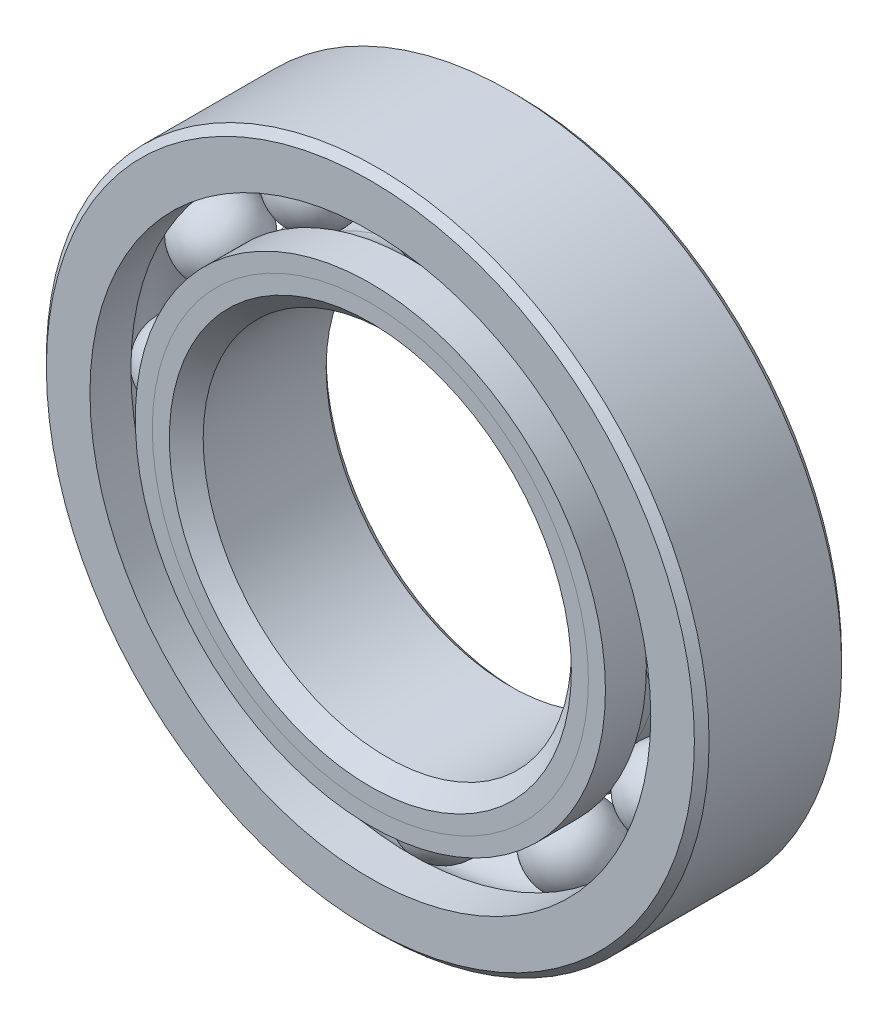
from build123d import *

# Parameters (mm, degrees)
CIRPATTERN1_COUNT = 12


with BuildPart() as part:
    # Sketch1 → Revolve1 (revolve)
    with BuildSketch(Plane(origin=(0, 0, 0), x_dir=(0, 0, -1), z_dir=(1, 0, 0))):
        with BuildLine():
            Line((2.8575, 14.2875), (-2.8575, 14.2875))
            Line((-2.8575, 14.2875), (-3.175, 13.97))
            Line((-3.175, 13.97), (-3.175, 12.089423077))
            Line((-3.175, 12.089423077), (-1.411111111, 12.089423077))
            ThreePointArc((-1.411111111, 12.089423077), (0, 12.828778901), (1.411111111, 12.089423077))
            Line((1.411111111, 12.089423077), (3.175, 12.089423077))
            Line((3.175, 12.089423077), (3.175, 13.97))
            Line((3.175, 13.97), (2.8575, 14.2875))
        make_face()
    revolve(axis=Axis((0, 0, 3.175), (0, 0, -1)))


with BuildPart() as body_2:
    # Sketch2 → Revolve2 (revolve)
    with BuildSketch(Plane(origin=(0, 0, 0), x_dir=(0, 0, -1), z_dir=(1, 0, 0))):
        with BuildLine():
            Line((-3.175, 10.135576923), (-1.411111111, 10.135576923))
            ThreePointArc((-1.411111111, 10.135576923), (-0.796536503, 9.592255656), (0, 9.396221099))
            Line((0, 9.396221099), (0, 8.666860549))
            Line((0, 8.666860549), (-2.440641813, 8.666860549))
            Line((-2.440641813, 8.666860549), (-3.175, 9.401218736))
            Line((-3.175, 9.401218736), (-3.175, 10.135576923))
        make_face()
    revolve(axis=Axis((0, 0, 3.175), (0, 0, -1)))


with BuildPart() as body_3:
    # Sketch3 → Revolve3 (revolve)
    with BuildSketch(Plane(origin=(0, 0, 0), x_dir=(0, 0, -1), z_dir=(1, 0, 0))):
        with BuildLine():
            Line((-3.175, 9.401218736), (-2.440641813, 8.666860549))
            Line((-2.440641813, 8.666860549), (0, 8.666860549))
            Line((0, 8.666860549), (0, 9.396221099))
            ThreePointArc((0, 9.396221099), (0.796536503, 9.592255656), (1.411111111, 10.135576923))
            Line((1.411111111, 10.135576923), (3.175, 10.135576923))
            Line((3.175, 10.135576923), (3.175, 8.255))
            Line((3.175, 8.255), (2.8575, 7.9375))
            Line((2.8575, 7.9375), (-2.445639451, 7.9375))
            Line((-2.445639451, 7.9375), (-3.175, 8.666860549))
            Line((-3.175, 8.666860549), (-3.175, 9.401218736))
        make_face()
    revolve(axis=Axis((0, 0, 3.175), (0, 0, -1)))


with BuildPart() as body_4:
    # Sketch4 → Revolve4 (revolve)
    with BuildSketch(Plane(origin=(0, 0, 0), x_dir=(0, 0, -1), z_dir=(1, 0, 0))):
        with BuildLine():
            Line((-1.716278901, 11.1125), (1.716278901, 11.1125))
            ThreePointArc((1.716278901, 11.1125), (0, 12.828778901), (-1.716278901, 11.1125))
        make_face()
    revolve(axis=Axis((0, 11.1125, 1.716278901), (0, 0, -1)))


with BuildPart() as cirpattern1_1:
    # CirPattern1: pattern copy
    add(body_4.part.rotate(Axis((0, 0, -3.175), (0, 0, 1)), 1 * 360 / CIRPATTERN1_COUNT))


with BuildPart() as cirpattern1_2:
    # CirPattern1: pattern copy
    add(body_4.part.rotate(Axis((0, 0, -3.175), (0, 0, 1)), 2 * 360 / CIRPATTERN1_COUNT))


with BuildPart() as cirpattern1_3:
    # CirPattern1: pattern copy
    add(body_4.part.rotate(Axis((0, 0, -3.175), (0, 0, 1)), 3 * 360 / CIRPATTERN1_COUNT))


with BuildPart() as cirpattern1_4:
    # CirPattern1: pattern copy
    add(body_4.part.rotate(Axis((0, 0, -3.175), (0, 0, 1)), 4 * 360 / CIRPATTERN1_COUNT))


with BuildPart() as cirpattern1_5:
    # CirPattern1: pattern copy
    add(body_4.part.rotate(Axis((0, 0, -3.175), (0, 0, 1)), 5 * 360 / CIRPATTERN1_COUNT))


with BuildPart() as cirpattern1_6:
    # CirPattern1: pattern copy
    add(body_4.part.rotate(Axis((0, 0, -3.175), (0, 0, 1)), 6 * 360 / CIRPATTERN1_COUNT))


with BuildPart() as cirpattern1_7:
    # CirPattern1: pattern copy
    add(body_4.part.rotate(Axis((0, 0, -3.175), (0, 0, 1)), 7 * 360 / CIRPATTERN1_COUNT))


with BuildPart() as cirpattern1_8:
    # CirPattern1: pattern copy
    add(body_4.part.rotate(Axis((0, 0, -3.175), (0, 0, 1)), 8 * 360 / CIRPATTERN1_COUNT))


with BuildPart() as cirpattern1_9:
    # CirPattern1: pattern copy
    add(body_4.part.rotate(Axis((0, 0, -3.175), (0, 0, 1)), 9 * 360 / CIRPATTERN1_COUNT))


with BuildPart() as cirpattern1_10:
    # CirPattern1: pattern copy
    add(body_4.part.rotate(Axis((0, 0, -3.175), (0, 0, 1)), 10 * 360 / CIRPATTERN1_COUNT))


with BuildPart() as cirpattern1_11:
    # CirPattern1: pattern copy
    add(body_4.part.rotate(Axis((0, 0, -3.175), (0, 0, 1)), 11 * 360 / CIRPATTERN1_COUNT))


solid = Compound([part.part, body_2.part, body_3.part, body_4.part, cirpattern1_1.part, cirpattern1_2.part, cirpattern1_3.part, cirpattern1_4.part, cirpattern1_5.part, cirpattern1_6.part, cirpattern1_7.part, cirpattern1_8.part, cirpattern1_9.part, cirpattern1_10.part, cirpattern1_11.part])
